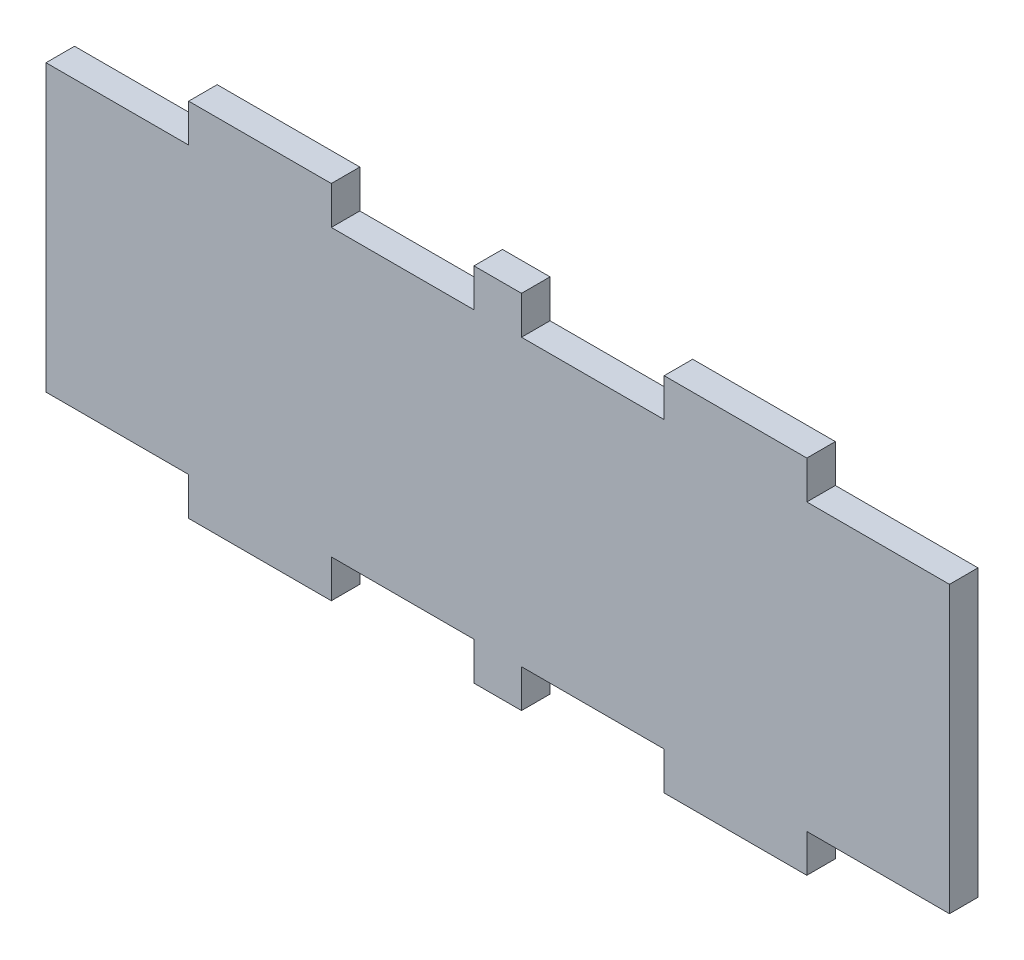
from build123d import *

# Parameters (mm, degrees)
SKETCH1_W           = 95
SKETCH1_H           = 30
BOSS_EXTRUDE1_DEPTH = 3
SKETCH3_W           = 15
SKETCH3_H           = 4
SKETCH3_W_2         = 5
BOSS_EXTRUDE2_DEPTH = 3


with BuildPart() as part:
    # Sketch1 → Boss-Extrude1 (new body)
    with BuildSketch(Plane.XY):
        with Locations((-47.5, 15)):
            Rectangle(SKETCH1_W, SKETCH1_H)
    extrude(amount=BOSS_EXTRUDE1_DEPTH)

    # Sketch3 → Boss-Extrude2 (add)
    with BuildSketch(Plane.XY.offset(3)):
        with Locations((-22.5, 32)):
            Rectangle(SKETCH3_W, SKETCH3_H)
        with Locations((-72.5, 32)):
            Rectangle(SKETCH3_W, SKETCH3_H)
        with Locations((-47.5, 32)):
            Rectangle(SKETCH3_W_2, SKETCH3_H)
        with Locations((-22.5, -2)):
            Rectangle(SKETCH3_W, SKETCH3_H)
        with Locations((-47.5, -2)):
            Rectangle(SKETCH3_W_2, SKETCH3_H)
        with Locations((-72.5, -2)):
            Rectangle(SKETCH3_W, SKETCH3_H)
    extrude(amount=-BOSS_EXTRUDE2_DEPTH)


solid = part.part
